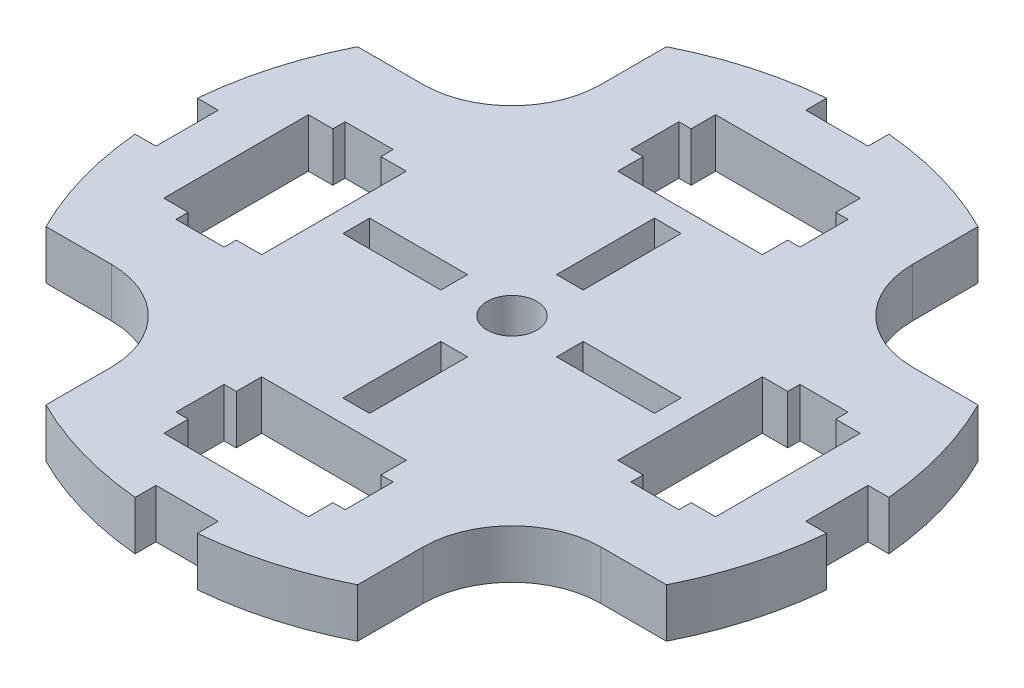
from build123d import *

# Parameters (mm, degrees)
SKETCH1_R           = 2.8
SKETCH1_W           = 3
SKETCH1_H           = 11
SKETCH1_W_2         = 11
SKETCH1_H_2         = 3
BOSS_EXTRUDE1_DEPTH = 5.5
FILLET1_R           = 10
FILLET2_R           = 10
FILLET3_R           = 10
FILLET4_R           = 10


with BuildPart() as part:
    # Sketch1 → Boss-Extrude1 (new body)
    with BuildSketch(Plane(origin=(0, 0, 0), x_dir=(1, 0, 0), z_dir=(0, 1, 0))):
        with BuildLine():
            Line((-3.5, 38.842631219), (-3.5, 36.5))
            Line((-3.5, 36.5), (3.5, 36.5))
            Line((3.5, 36.5), (3.5, 38.842631219))
            ThreePointArc((3.5, 38.842631219), (10.687785693, 37.506949182), (17.5, 34.853263836))
            Line((17.5, 34.853263836), (17.5, 17.5))
            Line((17.5, 17.5), (34.853263836, 17.5))
            ThreePointArc((34.853263836, 17.5), (37.506949182, 10.687785693), (38.842631219, 3.5))
            Line((38.842631219, 3.5), (36.5, 3.5))
            Line((36.5, 3.5), (36.5, -3.5))
            Line((36.5, -3.5), (38.842631219, -3.5))
            ThreePointArc((38.842631219, -3.5), (37.506949182, -10.687785693), (34.853263836, -17.5))
            Line((34.853263836, -17.5), (17.5, -17.5))
            Line((17.5, -17.5), (17.5, -34.853263836))
            ThreePointArc((17.5, -34.853263836), (10.687785693, -37.506949182), (3.5, -38.842631219))
            Line((3.5, -38.842631219), (3.5, -36.5))
            Line((3.5, -36.5), (-3.5, -36.5))
            Line((-3.5, -36.5), (-3.5, -38.842631219))
            ThreePointArc((-3.5, -38.842631219), (-10.687785693, -37.506949182), (-17.5, -34.853263836))
            Line((-17.5, -34.853263836), (-17.5, -17.5))
            Line((-17.5, -17.5), (-34.853263836, -17.5))
            ThreePointArc((-34.853263836, -17.5), (-37.506949182, -10.687785693), (-38.842631219, -3.5))
            Line((-38.842631219, -3.5), (-36.5, -3.5))
            Line((-36.5, -3.5), (-36.5, 3.5))
            Line((-36.5, 3.5), (-38.842631219, 3.5))
            ThreePointArc((-38.842631219, 3.5), (-37.506949182, 10.687785693), (-34.853263836, 17.5))
            Line((-34.853263836, 17.5), (-17.5, 17.5))
            Line((-17.5, 17.5), (-17.5, 34.853263836))
            ThreePointArc((-17.5, 34.853263836), (-10.687785693, 37.506949182), (-3.5, 38.842631219))
        make_face()
        with Locations(Location((0, 0, 0), (0, 0, 270))):
            Circle(SKETCH1_R, mode=Mode.SUBTRACT)
        Polygon((-8.125, 22.85), (-8.125, 20), (8.125, 20), (8.125, 22.85), (9.5, 22.85), (9.5, 28.25), (8.125, 28.25), (8.125, 31), (-8.125, 31), (-8.125, 28.25), (-9.5, 28.25), (-9.5, 22.85), align=None, mode=Mode.SUBTRACT)
        with Locations((0, 12)):
            Rectangle(SKETCH1_W, SKETCH1_H, mode=Mode.SUBTRACT)
        Polygon((22.85, 8.125), (20, 8.125), (20, -8.125), (22.85, -8.125), (22.85, -9.5), (28.25, -9.5), (28.25, -8.125), (31, -8.125), (31, 8.125), (28.25, 8.125), (28.25, 9.5), (22.85, 9.5), align=None, mode=Mode.SUBTRACT)
        with Locations((12, 0)):
            Rectangle(SKETCH1_W_2, SKETCH1_H_2, mode=Mode.SUBTRACT)
        Polygon((8.125, -22.85), (8.125, -20), (-8.125, -20), (-8.125, -22.85), (-9.5, -22.85), (-9.5, -28.25), (-8.125, -28.25), (-8.125, -31), (8.125, -31), (8.125, -28.25), (9.5, -28.25), (9.5, -22.85), align=None, mode=Mode.SUBTRACT)
        with Locations((0, -12)):
            Rectangle(SKETCH1_W, SKETCH1_H, mode=Mode.SUBTRACT)
        Polygon((-22.85, -8.125), (-20, -8.125), (-20, 8.125), (-22.85, 8.125), (-22.85, 9.5), (-28.25, 9.5), (-28.25, 8.125), (-31, 8.125), (-31, -8.125), (-28.25, -8.125), (-28.25, -9.5), (-22.85, -9.5), align=None, mode=Mode.SUBTRACT)
        with Locations((-12, 0)):
            Rectangle(SKETCH1_W_2, SKETCH1_H_2, mode=Mode.SUBTRACT)
    extrude(amount=BOSS_EXTRUDE1_DEPTH)

    # Fillet1
    fillet1_edges = [part.edges().sort_by_distance(p)[0] for p in [
        (-17.5, 2.75, 17.5),
    ]]
    fillet(fillet1_edges, radius=FILLET1_R)

    # Fillet2
    fillet2_edges = [part.edges().sort_by_distance(p)[0] for p in [
        (17.5, 2.75, 17.5),
    ]]
    fillet(fillet2_edges, radius=FILLET2_R)

    # Fillet3
    fillet3_edges = [part.edges().sort_by_distance(p)[0] for p in [
        (17.5, 2.75, -17.5),
    ]]
    fillet(fillet3_edges, radius=FILLET3_R)

    # Fillet4
    fillet4_edges = [part.edges().sort_by_distance(p)[0] for p in [
        (-17.5, 2.75, -17.5),
    ]]
    fillet(fillet4_edges, radius=FILLET4_R)


solid = part.part
